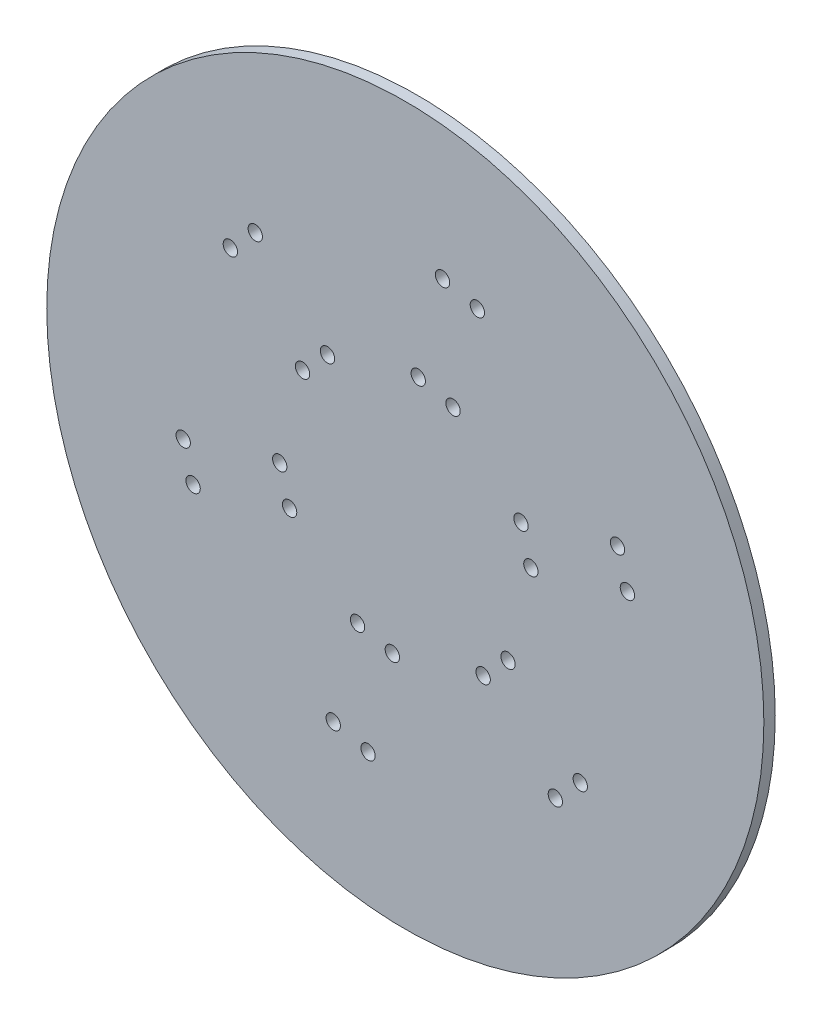
from build123d import *

# Parameters (mm, degrees)
SKETCH1_R           = 100
BOSS_EXTRUDE1_DEPTH = 3.175
SKETCH6_R           = 2
CUT_EXTRUDE1_DEPTH  = 142.456992139


with BuildPart() as part:
    # Sketch1 → Boss-Extrude1 (new body)
    with BuildSketch(Plane.XY):
        Circle(SKETCH1_R)
    extrude(amount=BOSS_EXTRUDE1_DEPTH)

    # Sketch6 → Cut-Extrude1 (cut, through all)
    with BuildSketch(Plane.XY.offset(3.175)):
        with Locations((61.93746735, 12.559862193)):
            Circle(SKETCH6_R)
        with Locations((59.180935915, 22.17243388)):
            Circle(SKETCH6_R)
        with Locations((35.022266624, 4.841574176)):
            Circle(SKETCH6_R)
        with Locations((32.26573519, 14.454145864)):
            Circle(SKETCH6_R)
        with Locations((13.318207081, 32.750959683)):
            Circle(SKETCH6_R)
        with Locations((3.615210086, 35.170019278)):
            Circle(SKETCH6_R)
        with Locations((20.091573948, 59.919351267)):
            Circle(SKETCH6_R)
        with Locations((10.388576953, 62.338410863)):
            Circle(SKETCH6_R)
        with Locations((-21.704059543, 27.909385506)):
            Circle(SKETCH6_R)
        with Locations((-28.650525103, 20.715873414)):
            Circle(SKETCH6_R)
        with Locations((-41.845893402, 47.359489075)):
            Circle(SKETCH6_R)
        with Locations((-48.792358962, 40.165976982)):
            Circle(SKETCH6_R)
        with Locations((-35.022266624, -4.841574176)):
            Circle(SKETCH6_R)
        with Locations((-32.26573519, -14.454145864)):
            Circle(SKETCH6_R)
        with Locations((-61.93746735, -12.559862193)):
            Circle(SKETCH6_R)
        with Locations((-59.180935915, -22.17243388)):
            Circle(SKETCH6_R)
        with Locations((-3.615210086, -35.170019278)):
            Circle(SKETCH6_R)
        with Locations((-13.318207081, -32.750959683)):
            Circle(SKETCH6_R)
        with Locations((-10.388576953, -62.338410863)):
            Circle(SKETCH6_R)
        with Locations((-20.091573948, -59.919351267)):
            Circle(SKETCH6_R)
        with Locations((28.650525103, -20.715873414)):
            Circle(SKETCH6_R)
        with Locations((48.792358962, -40.165976982)):
            Circle(SKETCH6_R)
        with Locations((41.845893402, -47.359489075)):
            Circle(SKETCH6_R)
        with Locations((21.706133595, -27.876828536)):
            Circle(SKETCH6_R)
    extrude(amount=-CUT_EXTRUDE1_DEPTH, mode=Mode.SUBTRACT)


solid = part.part
